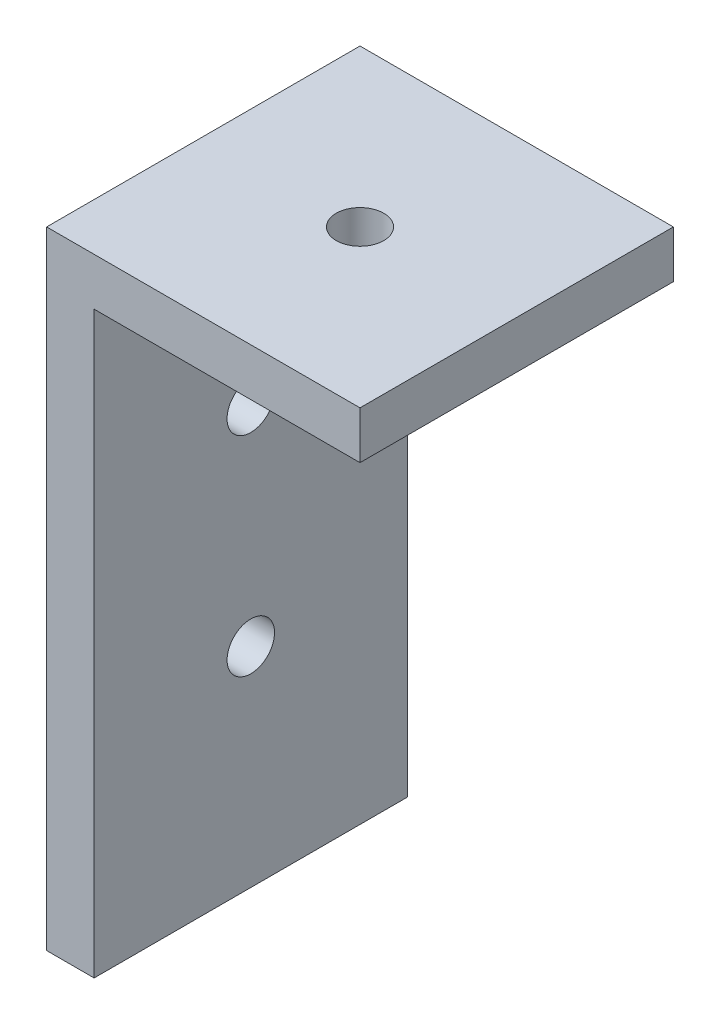
from build123d import *

# Parameters (mm, degrees)
BOSS_EXTRUDE1_DEPTH = 19.8
SKETCH2_R           = 1.5
CUT_EXTRUDE1_DEPTH  = 19.8
SKETCH3_R           = 1.5
CUT_EXTRUDE2_DEPTH  = 19.8


with BuildPart() as part:
    # Sketch1 → Boss-Extrude1 (new body)
    with BuildSketch(Plane.XY):
        Polygon((0, 0), (0, 36.6), (16.8, 36.6), (16.8, 39.6), (-3, 39.6), (-3, 0), align=None)
    extrude(amount=BOSS_EXTRUDE1_DEPTH)

    # Sketch2 → Cut-Extrude1 (cut)
    with BuildSketch(Plane(origin=(0, 39.6, 0), x_dir=(1, 0, 0), z_dir=(0, 1, 0))):
        with Locations(Location((6.9, -9.9, 0), (0, 0, 180))):
            Circle(SKETCH2_R)
    extrude(amount=-CUT_EXTRUDE1_DEPTH, mode=Mode.SUBTRACT)

    # Sketch3 → Cut-Extrude2 (cut)
    with BuildSketch(Plane.ZY.offset(3)):
        with Locations(Location((9.9, 26.4, 0), (0, 0, 270))):
            Circle(SKETCH3_R)
        with Locations(Location((9.9, 13.2, 0), (0, 0, 270))):
            Circle(SKETCH3_R)
    extrude(amount=-CUT_EXTRUDE2_DEPTH, mode=Mode.SUBTRACT)


solid = part.part
